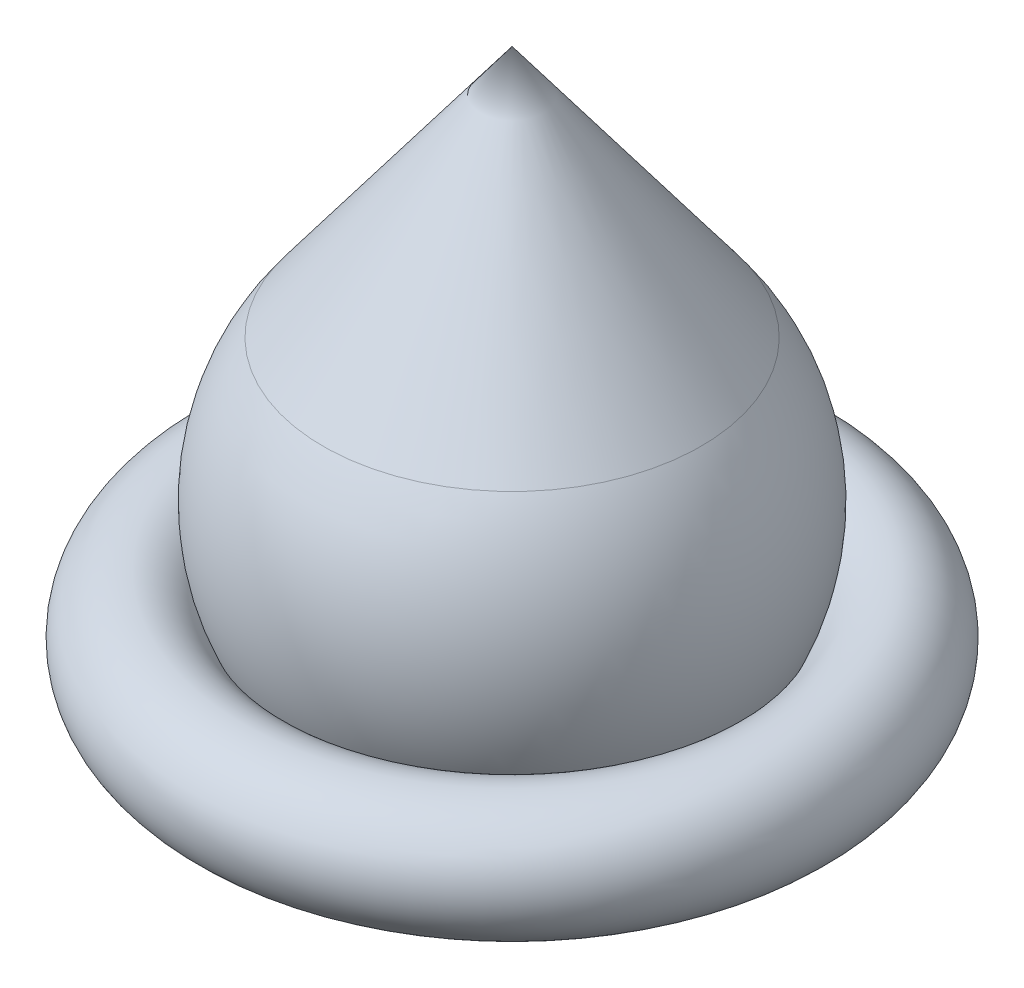
from build123d import *

# Parameters (mm, degrees)
SKETCH1_R = 2.38125


with BuildPart() as part:
    # Sketch1 → Revolve1 (revolve)
    with BuildSketch(Plane.XY):
        with Locations((-10.912258374, 4.7625)):
            Circle(SKETCH1_R)
        with BuildLine():
            Line((0, 25.4), (-7.62, 15.24))
            ThreePointArc((-7.62, 15.24), (-8.519418994, 5.265290503), (0, 0))
            Line((0, 0), (0, 25.4))
        make_face()
    revolve(axis=Axis((0, 0, 0), (0, 1, 0)))


solid = part.part
